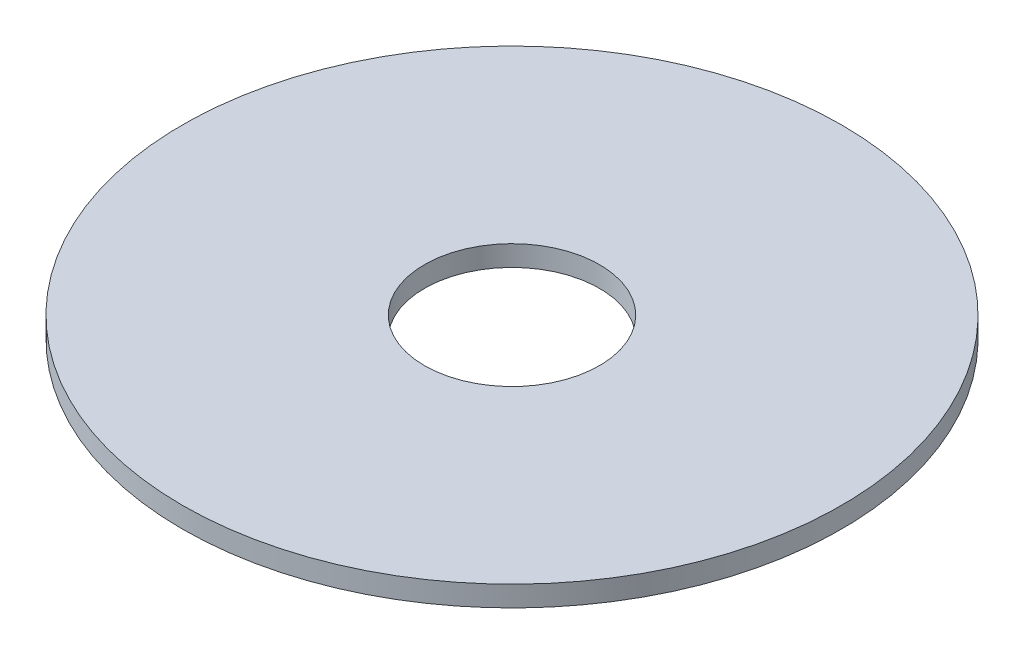
from build123d import *

# Parameters (mm, degrees)
SKETCH1_R                         = 25.4
BOSS_EXTRUDE1_DEPTH               = 1.5875
F_1_2_CLEARANCE_HOLE1_D           = 13.49248
F_1_2_CLEARANCE_HOLE1_ON_FACE_2_D = 13.49248


with BuildPart() as part:
    # Sketch1 → Boss-Extrude1 (new body)
    with BuildSketch(Plane(origin=(0, 0, 0), x_dir=(1, 0, 0), z_dir=(0, 1, 0))):
        with Locations(Location((0, 0, 0), (0, 0, 270))):
            Circle(SKETCH1_R)
    extrude(amount=BOSS_EXTRUDE1_DEPTH)

    # 1/2 Clearance Hole1 (through all)
    with Locations(Plane(origin=(0, 0, 0), x_dir=(0, 0, -1), z_dir=(0, -1, 0))):
        with Locations((0, 0)):
            Hole(F_1_2_CLEARANCE_HOLE1_D / 2)

    # 1/2 Clearance Hole1 on face 2 (through all)
    with Locations(Plane.ZX.offset(1.5875)):
        with Locations((0, 0)):
            Hole(F_1_2_CLEARANCE_HOLE1_ON_FACE_2_D / 2)


solid = part.part
